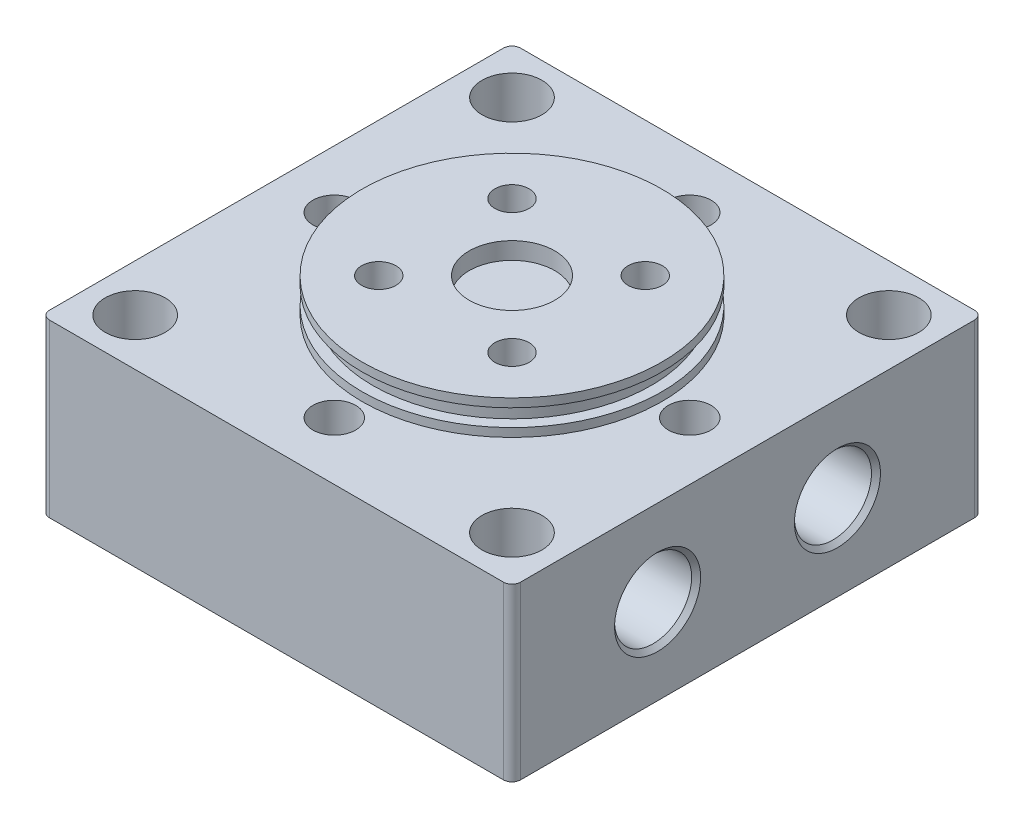
from build123d import *

# Parameters (mm, degrees)
SKETCH_1_W               = 55
SKETCH_1_H               = 55
EXTRUDE_1_DEPTH          = 10
SKETCH_2_R               = 17.5
EXTRUDE_2_DEPTH          = 1
SKETCH_3_R               = 16.25
EXTRUDE_3_DEPTH          = 2
SKETCH_4_R               = 17.5
EXTRUDE_4_DEPTH          = 1
SKETCH_5_R               = 4.25
CUT_EXTRUDE_1_DEPTH      = 3
SKETCH_6_R               = 2.5
CUT_EXTRUDE_2_DEPTH      = 45.198416261
SKETCH_7_R               = 3.5
CUT_EXTRUDE_3_DEPTH      = 46.700109409
PATTERN_CIRCULAR_1_COUNT = 4
SKETCH_10_R              = 5
CUT_EXTRUDE_4_DEPTH      = 2
SKETCH_11_R              = 2
CUT_EXTRUDE_5_DEPTH      = 14
PATTERN_CIRCULAR_2_COUNT = 4
FILLET_1_R               = 1
CHAMFER_1_SIZE           = 0.5
CHAMFER_2_SIZE           = 1


with BuildPart() as part:
    # 草图1 → 凸台-拉伸1 (new, symmetric)
    with BuildSketch(Plane(origin=(0, 0, 0), x_dir=(1, 0, 0), z_dir=(0, 1, 0))):
        Rectangle(SKETCH_1_W, SKETCH_1_H)
    extrude(amount=EXTRUDE_1_DEPTH, both=True)

    # 草图2 → 凸台-拉伸2 (add)
    with BuildSketch(Plane(origin=(0, 10, 0), x_dir=(1, 0, 0), z_dir=(0, 1, 0))):
        Circle(SKETCH_2_R)
    extrude(amount=EXTRUDE_2_DEPTH)

    # 草图3 → 凸台-拉伸3 (add)
    with BuildSketch(Plane(origin=(0, 11, 0), x_dir=(1, 0, 0), z_dir=(0, 1, 0))):
        Circle(SKETCH_3_R)
    extrude(amount=EXTRUDE_3_DEPTH)

    # 草图4 → 凸台-拉伸4 (add)
    with BuildSketch(Plane(origin=(0, 13, 0), x_dir=(1, 0, 0), z_dir=(0, 1, 0))):
        Circle(SKETCH_4_R)
    extrude(amount=EXTRUDE_4_DEPTH)

    # 草图5 → 切除-拉伸1 (cut)
    with BuildSketch(Plane.XZ.offset(10)):
        with Locations((0, 20.75)):
            Circle(SKETCH_5_R)
    cut_extrude_1 = extrude(amount=-CUT_EXTRUDE_1_DEPTH, mode=Mode.SUBTRACT)

    # 草图6 → 切除-拉伸2 (cut, through all)
    with BuildSketch(Plane.XZ.offset(7)):
        with Locations((0, 20.75)):
            Circle(SKETCH_6_R)
    cut_extrude_2 = extrude(amount=-CUT_EXTRUDE_2_DEPTH, mode=Mode.SUBTRACT)

    # 草图7 → 切除-拉伸3 (cut, through all)
    with BuildSketch(Plane.XZ.offset(10)):
        with Locations((-22, 22)):
            Circle(SKETCH_7_R)
    cut_extrude_3 = extrude(amount=-CUT_EXTRUDE_3_DEPTH, mode=Mode.SUBTRACT)

    # 阵列(圆周)1: 切除-拉伸1, 切除-拉伸2, 切除-拉伸3 ×4 about axis
    pattern_circular_1_axis = Axis((0, 14, 0), (0, -1, 0))
    add([cut_extrude_1.rotate(pattern_circular_1_axis, i * 360 / PATTERN_CIRCULAR_1_COUNT) for i in range(1, PATTERN_CIRCULAR_1_COUNT)], mode=Mode.SUBTRACT)
    add([cut_extrude_2.rotate(pattern_circular_1_axis, i * 360 / PATTERN_CIRCULAR_1_COUNT) for i in range(1, PATTERN_CIRCULAR_1_COUNT)], mode=Mode.SUBTRACT)
    add([cut_extrude_3.rotate(pattern_circular_1_axis, i * 360 / PATTERN_CIRCULAR_1_COUNT) for i in range(1, PATTERN_CIRCULAR_1_COUNT)], mode=Mode.SUBTRACT)

    # 草图9 → M10x1.0 螺纹孔1 (revolve, cut)
    with BuildSketch(Plane(origin=(-27.5, 0, -10.5), x_dir=(0, 0, 1), z_dir=(0, 1, 0))):
        Polygon((0, 0), (0, 24.703872786), (4.5, 22), (4.5, 0.525), (5.025, 0), align=None)
    m10x1_0_1 = revolve(axis=Axis((-33.85, 0, -10.5), (1, 0, 0)), mode=Mode.SUBTRACT)

    # 镜向1: M10x1.0 螺纹孔1 across plane
    add(m10x1_0_1.mirror(Plane(origin=(0, 0, 0), x_dir=(0, 0, 1), z_dir=(1, 0, 0))), mode=Mode.SUBTRACT)

    # 镜向1 at the second plane: M10x1.0 螺纹孔1 across plane
    add(m10x1_0_1.mirror(Plane.XY), mode=Mode.SUBTRACT)

    # 镜向1 at the second plane copy 1 sket → 镜向1 at the second plane copy 1 (revolve, cut)
    with BuildSketch(Plane(origin=(27.5, 0, 10.5), x_dir=(0, 0, -1), z_dir=(0, 1, 0))):
        Polygon((0, 0), (0, 24.703872786), (4.5, 22), (4.5, 0.525), (5.025, 0), align=None)
    revolve(axis=Axis((33.85, 0, 10.5), (-1, 0, 0)), mode=Mode.SUBTRACT)

    # 草图10 → 切除-拉伸4 (cut)
    with BuildSketch(Plane(origin=(0, 14, 0), x_dir=(1, 0, 0), z_dir=(0, 1, 0))):
        Circle(SKETCH_10_R)
    extrude(amount=-CUT_EXTRUDE_4_DEPTH, mode=Mode.SUBTRACT)

    # 草图11 → 切除-拉伸5 (cut)
    with BuildSketch(Plane(origin=(0, 14, 0), x_dir=(1, 0, 0), z_dir=(0, 1, 0))):
        with Locations((7.778174593, 7.778174593)):
            Circle(SKETCH_11_R)
    cut_extrude_5 = extrude(amount=-CUT_EXTRUDE_5_DEPTH, mode=Mode.SUBTRACT)

    # 阵列(圆周)2: 切除-拉伸5 ×4 about axis
    pattern_circular_2_axis = Axis((0, 14, 0), (0, 1, 0))
    for i in range(1, PATTERN_CIRCULAR_2_COUNT):
        add(cut_extrude_5.rotate(pattern_circular_2_axis, i * 360 / PATTERN_CIRCULAR_2_COUNT), mode=Mode.SUBTRACT)

    # 圆角1
    fillet_1_edges = [part.edges().sort_by_distance(p)[0] for p in [
        (-27.5, 0, -27.5),
        (27.5, 0, -27.5),
        (27.5, 0, 27.5),
        (-27.5, 0, 27.5),
    ]]
    fillet(fillet_1_edges, radius=FILLET_1_R)

    # 倒角1
    chamfer_1_edges = [part.edges().sort_by_distance(p)[0] for p in [
        (-20.75, -10, -4.25),
        (4.25, -10, -20.75),
        (-4.25, -10, 20.75),
        (20.75, -10, 4.25),
    ]]
    chamfer(chamfer_1_edges, length=CHAMFER_1_SIZE)

    # 倒角2
    chamfer_2_edges = [part.edges().sort_by_distance(p)[0] for p in [
        (-25.5, -10, 22),
        (-22, -10, -25.5),
        (25.5, -10, -22),
        (22, -10, 25.5),
    ]]
    chamfer(chamfer_2_edges, length=CHAMFER_2_SIZE)


solid = part.part
